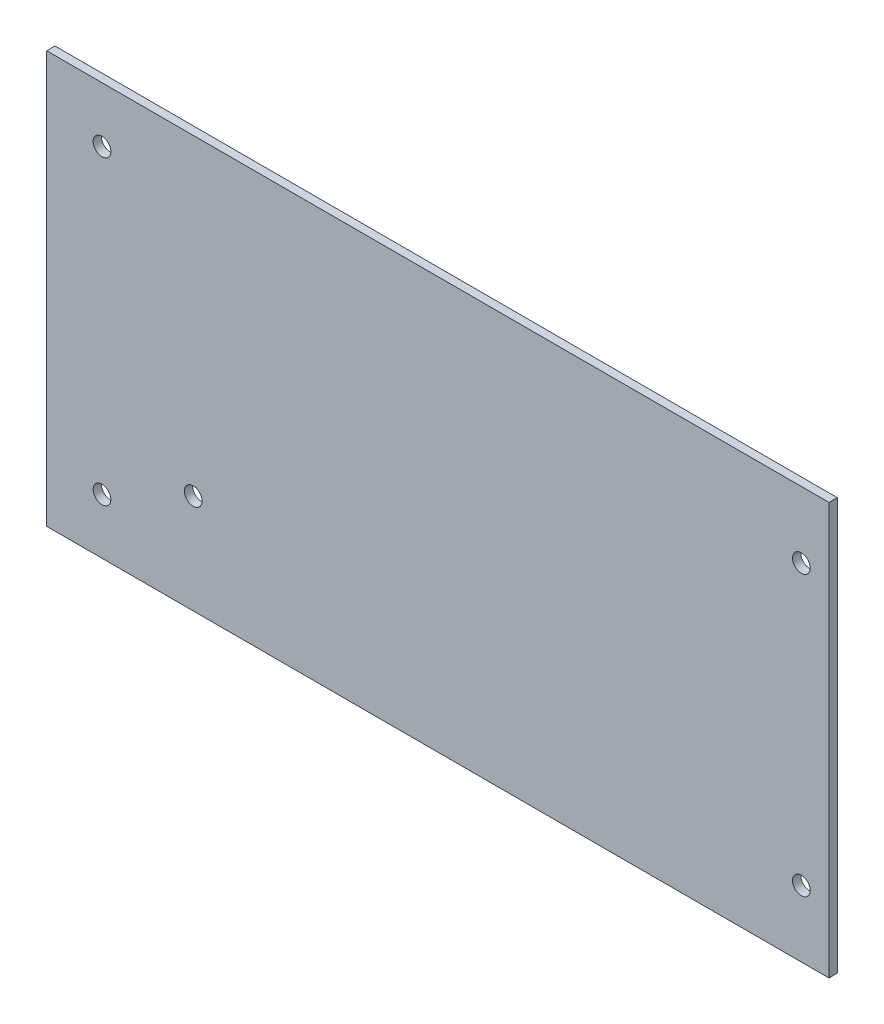
from build123d import *

# Parameters (mm, degrees)
SKETCH1_W           = 141.5
SKETCH1_H           = 74.5
BOSS_EXTRUDE1_DEPTH = 1.5
SKETCH2_R           = 1.6
CUT_EXTRUDE1_DEPTH  = 1.5
SKETCH3_R           = 1.6
CUT_EXTRUDE2_DEPTH  = 1.5
SKETCH4_R           = 1.6
CUT_EXTRUDE3_DEPTH  = 1.5


with BuildPart() as part:
    # Sketch1 → Boss-Extrude1 (new body)
    with BuildSketch(Plane.XY):
        with Locations((0.787232686, 37.25)):
            Rectangle(SKETCH1_W, SKETCH1_H)
    extrude(amount=BOSS_EXTRUDE1_DEPTH)

    # Sketch2 → Cut-Extrude1 (cut)
    with BuildSketch(Plane.XY.offset(1.5)):
        with Locations((-59.962767314, 64.5)):
            Circle(SKETCH2_R)
        with Locations((-59.962767314, 10)):
            Circle(SKETCH2_R)
    extrude(amount=-CUT_EXTRUDE1_DEPTH, mode=Mode.SUBTRACT)

    # Sketch3 → Cut-Extrude2 (cut)
    with BuildSketch(Plane.XY.offset(1.5)):
        with Locations((66.537232686, 62.5)):
            Circle(SKETCH3_R)
        with Locations((66.537232686, 12)):
            Circle(SKETCH3_R)
    extrude(amount=-CUT_EXTRUDE2_DEPTH, mode=Mode.SUBTRACT)

    # Sketch4 → Cut-Extrude3 (cut)
    with BuildSketch(Plane.XY.offset(1.5)):
        with Locations((-43.462767314, 18)):
            Circle(SKETCH4_R)
    extrude(amount=-CUT_EXTRUDE3_DEPTH, mode=Mode.SUBTRACT)


solid = part.part
